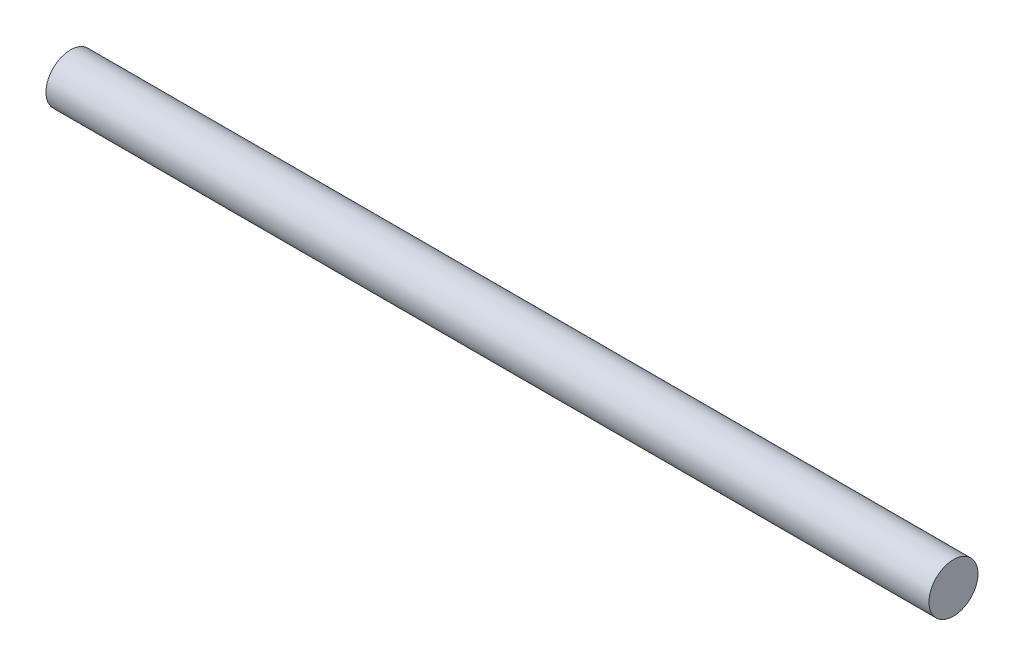
from build123d import *

# Parameters (mm, degrees)
SKETCH1_R           = 2.5
BOSS_EXTRUDE1_DEPTH = 90


with BuildPart() as part:
    # Sketch1 → Boss-Extrude1 (new body)
    with BuildSketch(Plane(origin=(0, 0, 0), x_dir=(0, 0, -1), z_dir=(1, 0, 0))):
        Circle(SKETCH1_R)
    extrude(amount=-BOSS_EXTRUDE1_DEPTH)


solid = part.part
